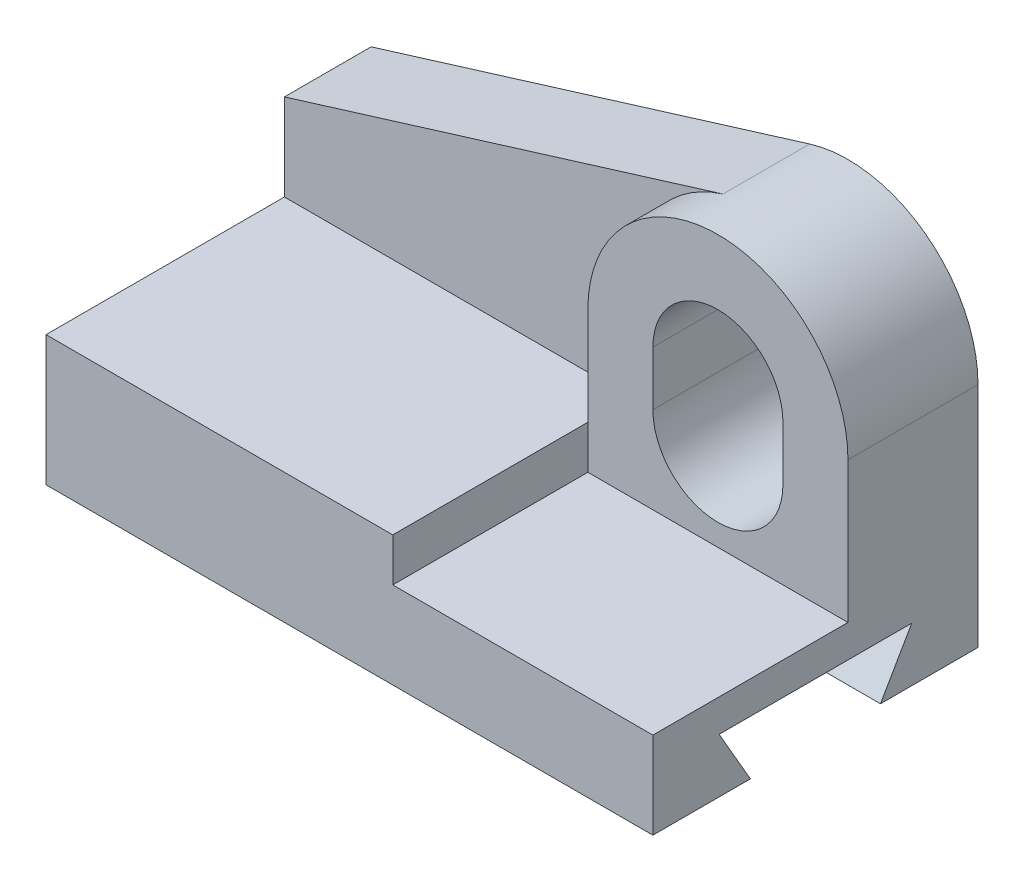
from build123d import *

# Parameters (mm, degrees)
EXTRUDE_1_DEPTH     = 30
EXTRUDE_2_DEPTH     = 8
EXTRUDE_3_DEPTH     = 12
CUT_EXTRUDE_1_DEPTH = 72.589105316


with BuildPart() as part:
    # 草图1 → 凸台-拉伸1 (new body)
    with BuildSketch(Plane.XY):
        Polygon((0, 12), (0, 0), (56, 0), (56, 8), (32, 8), (32, 12), align=None)
    extrude(amount=EXTRUDE_1_DEPTH)

    # 草图1<4> → 凸台-拉伸2 (add)
    with BuildSketch(Plane.XY):
        with BuildLine():
            Line((0, 20), (0, 12))
            Line((0, 12), (32, 12))
            Line((32, 12), (32, 21))
            ThreePointArc((32, 21), (34.345975777, 28.127398986), (40.466636051, 32.468013743))
            Line((40.466636051, 32.468013743), (0, 20))
        make_face()
    extrude(amount=EXTRUDE_2_DEPTH)

    # 草图1<5> → 凸台-拉伸3 (add)
    with BuildSketch(Plane.XY):
        with BuildLine():
            Line((32, 8), (56, 8))
            Line((56, 8), (56, 21))
            ThreePointArc((56, 21), (51.127398986, 30.654024223), (40.466636051, 32.468013743))
            ThreePointArc((40.466636051, 32.468013743), (34.345975777, 28.127398986), (32, 21))
            Line((32, 21), (32, 12))
            Line((32, 12), (32, 8))
        make_face()
        with BuildLine():
            ThreePointArc((38, 21), (44, 27), (50, 21))
            Line((50, 21), (50, 16))
            ThreePointArc((50, 16), (44, 10), (38, 16))
            Line((38, 16), (38, 21))
        make_face(mode=Mode.SUBTRACT)
    extrude(amount=EXTRUDE_3_DEPTH)

    # 草图5 → 切除-拉伸1 (cut, through all)
    with BuildSketch(Plane.ZY):
        Polygon((9, 0), (6.113248654, 5), (23.886751346, 5), (21, 0), align=None)
    extrude(amount=-CUT_EXTRUDE_1_DEPTH, mode=Mode.SUBTRACT)


solid = part.part
